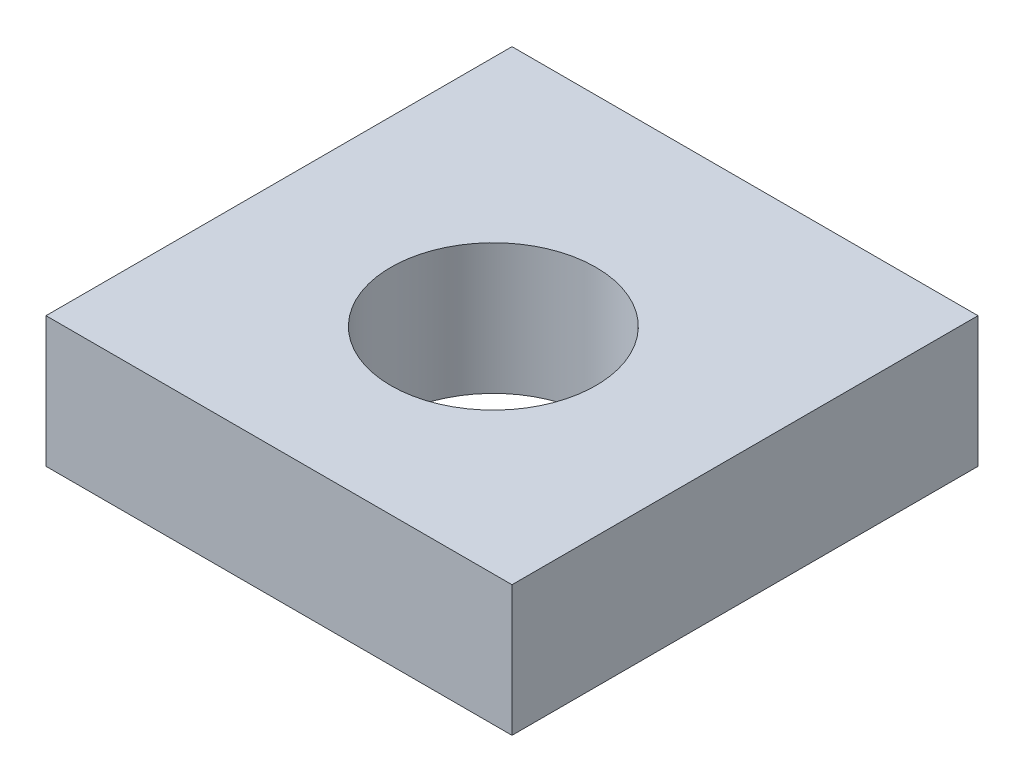
from build123d import *

# Parameters (mm, degrees)
SKETCH1_W           = 50
SKETCH1_H           = 50
BOSS_EXTRUDE1_DEPTH = 14
SKETCH2_R           = 11
CUT_EXTRUDE1_DEPTH  = 34


with BuildPart() as part:
    # Sketch1 → Boss-Extrude1 (new body)
    with BuildSketch(Plane(origin=(0, 478, 0), x_dir=(1, 0, 0), z_dir=(0, 1, 0))):
        with Locations((300, -155)):
            Rectangle(SKETCH1_W, SKETCH1_H)
    extrude(amount=BOSS_EXTRUDE1_DEPTH)

    # Sketch2 → Cut-Extrude1 (cut)
    with BuildSketch(Plane(origin=(0, 492, 0), x_dir=(1, 0, 0), z_dir=(0, 1, 0))):
        with Locations(Location((300, -157, 0), (0, 0, 270))):
            Circle(SKETCH2_R)
    extrude(amount=-CUT_EXTRUDE1_DEPTH, mode=Mode.SUBTRACT)


solid = part.part
